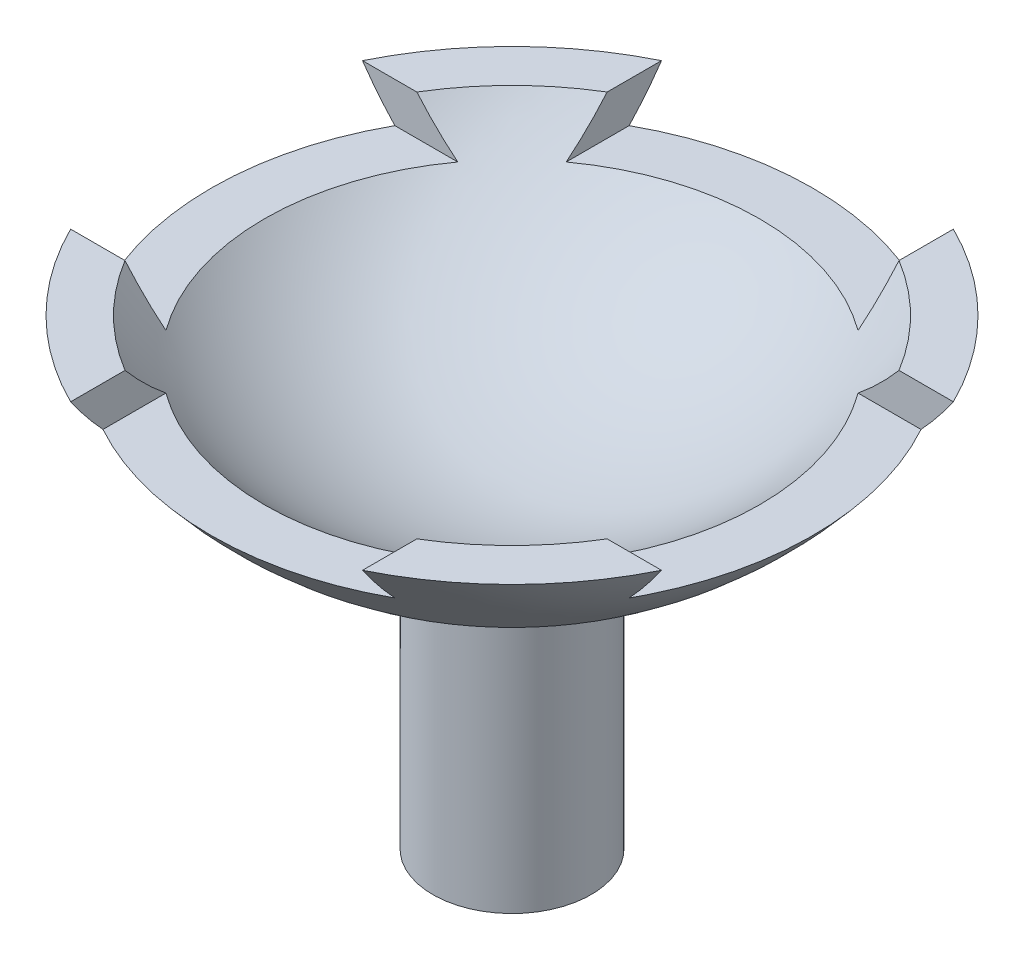
from build123d import *

# Parameters (mm, degrees)
CUT_EXTRUDE1_REACH = 51.712
SKETCH2_W          = 22.11
SKETCH2_H          = 3.04
CIRPATTERN1_COUNT  = 4
FILLET1_R          = 1.5


with BuildPart() as part:
    # Sketch1 → Revolve1 (revolve)
    with BuildSketch(Plane.XY):
        with BuildLine():
            Line((0, 24.131243893), (0, 21.131243893))
            Line((0, 21.131243893), (0, 0))
            Line((0, 0), (6, 0))
            Line((6, 0), (6, 21.75))
            ThreePointArc((6, 21.75), (16.839361195, 26.431536124), (24.962781559, 35))
            Line((24.962781559, 35), (21.348078676, 35))
            ThreePointArc((21.348078676, 35), (11.977795315, 27.004824289), (0, 24.131243893))
        make_face()
    revolve(axis=Axis((0, 21.131243893, 0), (0, -1, 0)))

    # Sketch2 → Cut-Extrude1 (cut, up to next)
    with BuildSketch(Plane.XY, mode=Mode.PRIVATE) as cut_extrude1_sk1:
        with Locations((0, 33.48)):
            Rectangle(SKETCH2_W, SKETCH2_H)
    cut_extrude1_tool1 = extrude(cut_extrude1_sk1.sketch, amount=-CUT_EXTRUDE1_REACH, mode=Mode.PRIVATE) & part.part
    cut_extrude1 = cut_extrude1_tool1.solids().sort_by_distance((0, 33.48, 0))[0]
    add(cut_extrude1, mode=Mode.SUBTRACT)

    # CirPattern1: Cut-Extrude1 ×4 about axis
    cirpattern1_axis = Axis((0, 0, 0), (0, 1, 0))
    for i in range(1, CIRPATTERN1_COUNT):
        add(cut_extrude1.rotate(cirpattern1_axis, i * 360 / CIRPATTERN1_COUNT), mode=Mode.SUBTRACT)

    # Fillet1
    fillet1_edges = [part.edges().sort_by_distance(p)[0] for p in [
        (-6, 21.75, 0),
    ]]
    fillet(fillet1_edges, radius=FILLET1_R)


solid = part.part
